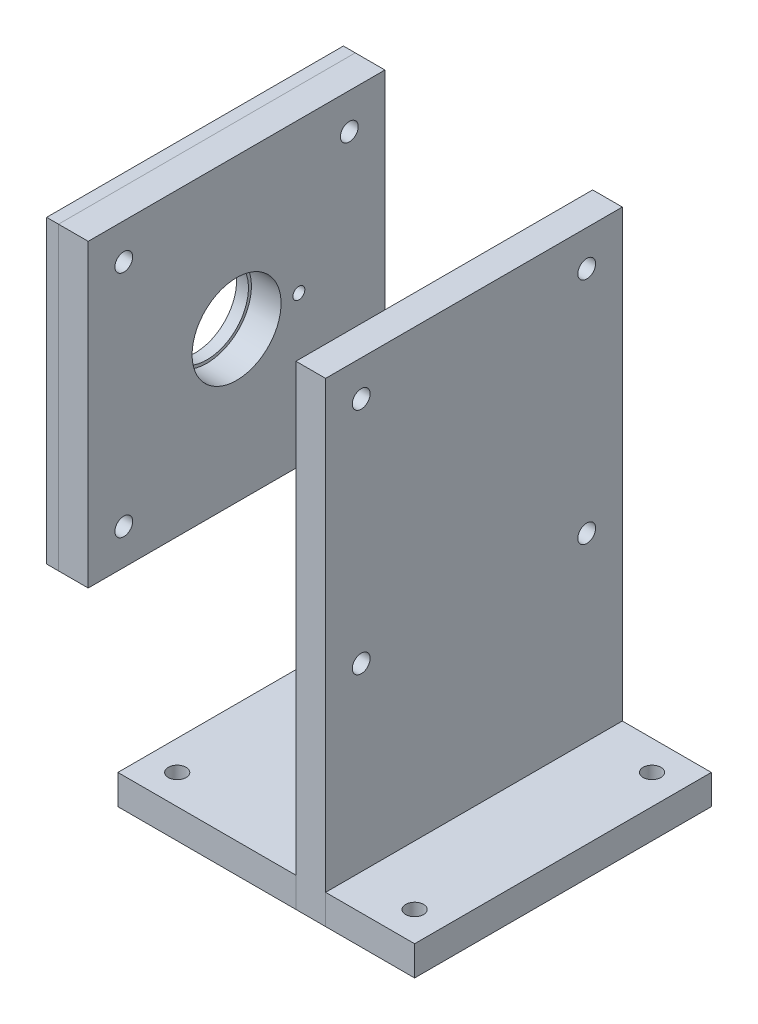
from build123d import *

# Parameters (mm, degrees)
SKETCH2_W           = 50
SKETCH2_H           = 80
BOSS_EXTRUDE1_DEPTH = 5
SKETCH3_R           = 1.5
SKETCH3_W           = 5
SKETCH3_H           = 41.168947864
BOSS_EXTRUDE2_DEPTH = 5
SKETCH6_W           = 50
SKETCH6_H           = 50.6
SKETCH6_R           = 7.5
SKETCH6_R_2         = 1
BOSS_EXTRUDE3_DEPTH = 5
SKETCH7_R           = 1.5
CUT_EXTRUDE1_DEPTH  = 104.07764064
SKETCH8_W           = 50
SKETCH8_H           = 50.6
SKETCH8_R           = 1.5
SKETCH8_R_2         = 7
SKETCH8_R_3         = 1
BOSS_EXTRUDE4_DEPTH = 2


with BuildPart() as part:
    # Sketch2 → Boss-Extrude1 (new body)
    with BuildSketch(Plane(origin=(0, 0, 0), x_dir=(0, 0, -1), z_dir=(1, 0, 0))):
        with Locations((0, 40)):
            Rectangle(SKETCH2_W, SKETCH2_H)
    extrude(amount=BOSS_EXTRUDE1_DEPTH)


with BuildPart() as body_2:
    # Sketch3 → Boss-Extrude2 (new body)
    with BuildSketch(Plane.XZ):
        Polygon((0, 25), (-30, 25), (-30, -25), (0, -25), (20, -25), (20, 25), align=None)
        with Locations(Location((-25, 20, 0), (0, 0, 270))):
            Circle(SKETCH3_R, mode=Mode.SUBTRACT)
        with Locations(Location((15, 20, 0), (0, 0, 270))):
            Circle(SKETCH3_R, mode=Mode.SUBTRACT)
        with Locations(Location((15, -20, 0), (0, 0, 90))):
            Circle(SKETCH3_R, mode=Mode.SUBTRACT)
        with Locations(Location((-25, -20, 0), (0, 0, 90))):
            Circle(SKETCH3_R, mode=Mode.SUBTRACT)
        with Locations((2.5, 1.553000457)):
            Rectangle(SKETCH3_W, SKETCH3_H, mode=Mode.SUBTRACT)
    extrude(amount=-BOSS_EXTRUDE2_DEPTH)


with BuildPart() as body_3:
    # Sketch6 → Boss-Extrude3 (new body)
    with BuildSketch(Plane.ZY.offset(35)):
        with Locations((0, 54.7)):
            Rectangle(SKETCH6_W, SKETCH6_H)
        with Locations((0, 54.7)):
            Circle(SKETCH6_R, mode=Mode.SUBTRACT)
        with Locations((-10.5, 54.7)):
            Circle(SKETCH6_R_2, mode=Mode.SUBTRACT)
    extrude(amount=BOSS_EXTRUDE3_DEPTH)


with BuildPart() as cut_extrude1_tool:
    # Sketch7 → Cut-Extrude1 (new, through all)
    with BuildSketch(Plane.ZY.offset(40)):
        with Locations((-19, 74)):
            Circle(SKETCH7_R)
        with Locations(Location((19, 74, 0), (0, 0, 180))):
            Circle(SKETCH7_R)
        with Locations((19, 35.4)):
            Circle(SKETCH7_R)
        with Locations(Location((-19, 35.4, 0), (0, 0, 180))):
            Circle(SKETCH7_R)
    extrude(amount=-CUT_EXTRUDE1_DEPTH)


with BuildPart() as part_1:
    add(part.part)

    # Cut-Extrude1: cut by cut_extrude1_tool
    add(cut_extrude1_tool.part, mode=Mode.SUBTRACT)


with BuildPart() as body_3_1:
    add(body_3.part)

    # Cut-Extrude1: cut by cut_extrude1_tool
    add(cut_extrude1_tool.part, mode=Mode.SUBTRACT)


with BuildPart() as body_4:
    # Sketch8 → Boss-Extrude4 (new body)
    with BuildSketch(Plane.ZY.offset(40)):
        with Locations((0, 54.7)):
            Rectangle(SKETCH8_W, SKETCH8_H)
        with Locations((-19, 74)):
            Circle(SKETCH8_R, mode=Mode.SUBTRACT)
        with Locations((19, 74)):
            Circle(SKETCH8_R, mode=Mode.SUBTRACT)
        with Locations((19, 35.4)):
            Circle(SKETCH8_R, mode=Mode.SUBTRACT)
        with Locations((-19, 35.4)):
            Circle(SKETCH8_R, mode=Mode.SUBTRACT)
        with Locations((0, 54.7)):
            Circle(SKETCH8_R_2, mode=Mode.SUBTRACT)
        with Locations((-10.5, 54.7)):
            Circle(SKETCH8_R_3, mode=Mode.SUBTRACT)
    extrude(amount=BOSS_EXTRUDE4_DEPTH)


solid = Compound([body_2.part, part_1.part, body_3_1.part, body_4.part])
